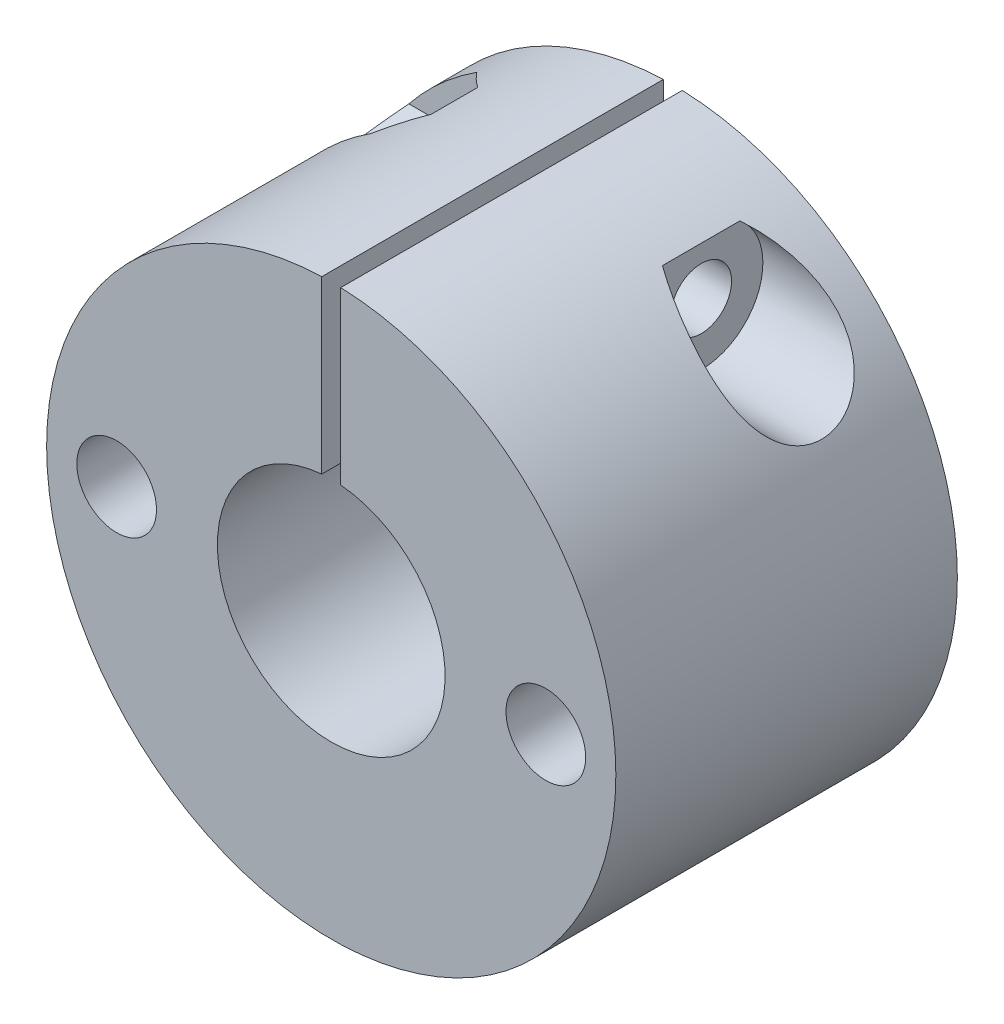
from build123d import *

# Parameters (mm, degrees)
SKETCH1_R               = 15
SKETCH1_R_2             = 6
BOSS_EXTRUDE1_DEPTH     = 10
CUT_EXTRUDE1_REACH      = 25.452
SKETCH2_W               = 1
SKETCH2_H               = 15
CUT_EXTRUDE2_DEPTH      = 30
CUT_EXTRUDE2_DEPTH_BACK = 30
SKETCH3_R               = 1.6
CUT_EXTRUDE3_START      = -6
SKETCH4_R               = 3.25
CUT_EXTRUDE3_DEPTH      = 30
CUT_EXTRUDE4_START      = -6
CUT_EXTRUDE4_DEPTH      = 30
CUT_EXTRUDE6_REACH      = 25.452
SKETCH10_R              = 2.1
SKETCH11_R              = 2.1
BOSS_EXTRUDE3_DEPTH     = 8


with BuildPart() as part:
    # Sketch1 → Boss-Extrude1 (new body)
    with BuildSketch(Plane.XY):
        Circle(SKETCH1_R)
        Circle(SKETCH1_R_2, mode=Mode.SUBTRACT)
    extrude(amount=BOSS_EXTRUDE1_DEPTH)

    # Sketch2 → Cut-Extrude1 (cut, up to next)
    with BuildSketch(Plane.XY.offset(10), mode=Mode.PRIVATE) as cut_extrude1_sk1:
        with Locations((0, 10.5)):
            Rectangle(SKETCH2_W, SKETCH2_H)
    cut_extrude1_tool1 = extrude(cut_extrude1_sk1.sketch, amount=-CUT_EXTRUDE1_REACH, mode=Mode.PRIVATE) & part.part
    add(cut_extrude1_tool1.solids().sort_by_distance((0, 10.5, 10))[0], mode=Mode.SUBTRACT)

    # Sketch3 → Cut-Extrude2 (cut, two sides: drawn at the far end of the back side and taken through both)
    with BuildSketch(Plane.ZY.offset(-0.5).offset(-CUT_EXTRUDE2_DEPTH_BACK)):
        with Locations((5, 10.991664351)):
            Circle(SKETCH3_R)
    extrude(amount=CUT_EXTRUDE2_DEPTH + CUT_EXTRUDE2_DEPTH_BACK, mode=Mode.SUBTRACT)

    # Sketch4 → Cut-Extrude3 (cut)
    with BuildSketch(Plane.ZY.offset(-0.5).offset(CUT_EXTRUDE3_START)):
        with Locations((5, 10.991664351)):
            Circle(SKETCH4_R)
    extrude(amount=-CUT_EXTRUDE3_DEPTH, mode=Mode.SUBTRACT)

    # Sketch5 → Cut-Extrude4 (cut)
    with BuildSketch(Plane(origin=(-0.5, 0, 0), x_dir=(0, 0, -1), z_dir=(1, 0, 0)).offset(CUT_EXTRUDE4_START)):
        Polygon((-2.2, 9.375083597), (-2.2, 12.608245104), (-5, 14.224825858), (-7.8, 12.608245104), (-7.8, 9.375083597), (-5, 7.758502843), align=None)
    extrude(amount=-CUT_EXTRUDE4_DEPTH, mode=Mode.SUBTRACT)

    # Sketch10 → Cut-Extrude6 (cut, up to next)
    with BuildSketch(Plane.XY.offset(10), mode=Mode.PRIVATE) as cut_extrude6_sk1:
        with Locations((11.31, 0)):
            Circle(SKETCH10_R)
    cut_extrude6_tool1 = extrude(cut_extrude6_sk1.sketch, amount=-CUT_EXTRUDE6_REACH, mode=Mode.PRIVATE) & part.part
    # Sketch10 → Cut-Extrude6 (cut, up to next)
    with BuildSketch(Plane.XY.offset(10), mode=Mode.PRIVATE) as cut_extrude6_sk2:
        with Locations((-11.31, 0)):
            Circle(SKETCH10_R)
    cut_extrude6_tool2 = extrude(cut_extrude6_sk2.sketch, amount=-CUT_EXTRUDE6_REACH, mode=Mode.PRIVATE) & part.part
    add(cut_extrude6_tool1.solids().sort_by_distance((11.31, 0, 10))[0], mode=Mode.SUBTRACT)
    add(cut_extrude6_tool2.solids().sort_by_distance((-11.31, 0, 10))[0], mode=Mode.SUBTRACT)

    # Sketch11 → Boss-Extrude3 (add)
    with BuildSketch(Plane.XY.offset(10)):
        with BuildLine():
            Line((0.5, 14.991664351), (0.5, 5.979130372))
            ThreePointArc((0.5, 5.979130372), (0, -6), (-0.5, 5.979130372))
            Line((-0.5, 5.979130372), (-0.5, 14.991664351))
            ThreePointArc((-0.5, 14.991664351), (0, -15), (0.5, 14.991664351))
        make_face()
        with Locations((11.31, 0)):
            Circle(SKETCH11_R, mode=Mode.SUBTRACT)
        with Locations((-11.31, 0)):
            Circle(SKETCH11_R, mode=Mode.SUBTRACT)
    extrude(amount=BOSS_EXTRUDE3_DEPTH)


solid = part.part
